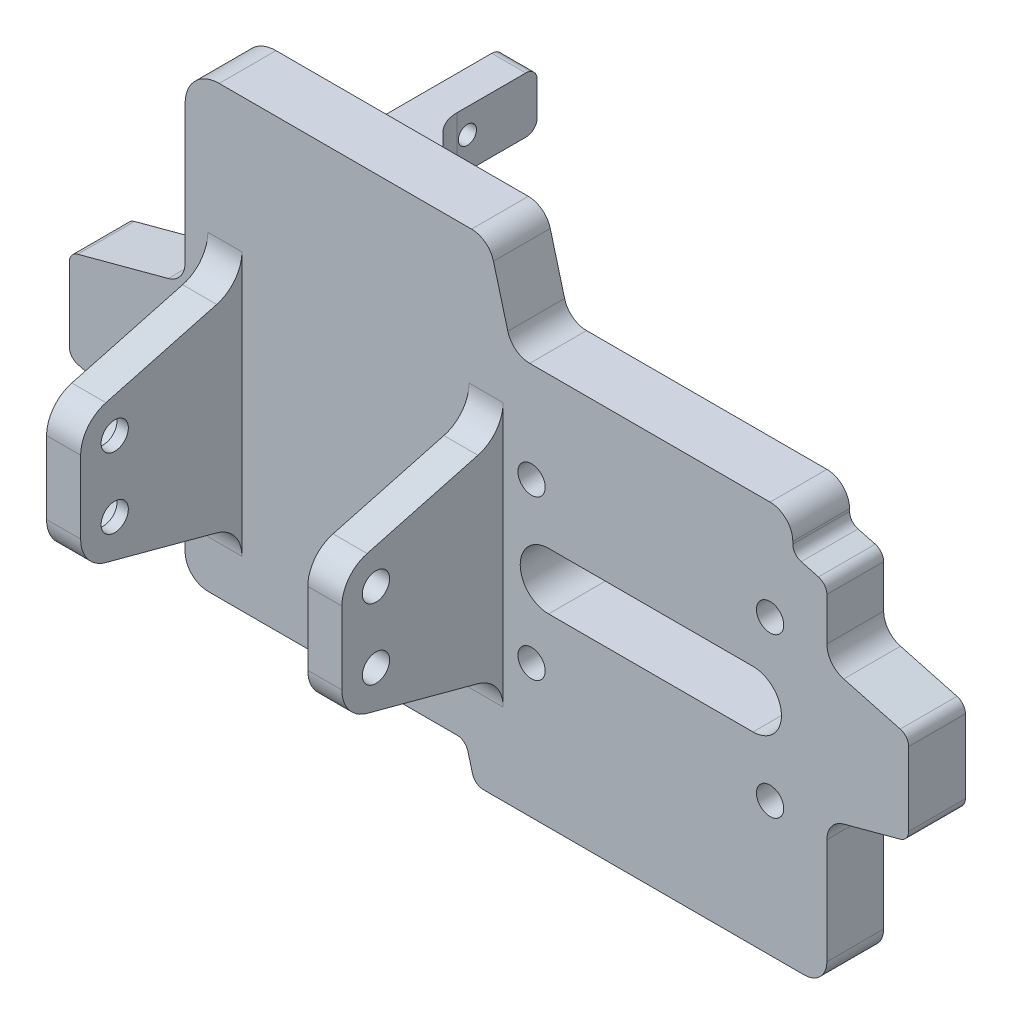
from build123d import *

# Parameters (mm, degrees)
SKETCH1_W                      = 53.5
SKETCH1_H                      = 31.55
BOSS_EXTRUDE1_DEPTH            = 2.5
BOSS_EXTRUDE2_DEPTH            = 5
FILLET1_R                      = 2
FILLET2_R                      = 1
BOSS_EXTRUDE3_DEPTH            = 3
FILLET3_R                      = 3
FILLET3_OF_MIRROR1_R           = 3
SKETCH4_W                      = 3
SKETCH4_H                      = 4.9
BOSS_EXTRUDE4_DEPTH            = 12.3
CHAMFER1_SIZE                  = 4
FILLET4_R                      = 3
FILLET5_R                      = 1
M2_CLEARANCE_HOLE1_D           = 2.4
M2X0_4_TAPPED_HOLE1_D          = 1.6
CBORE_FOR_M2_SHCS1_D           = 2.4
CBORE_FOR_M2_SHCS1_CBORE_D     = 4.4
CBORE_FOR_M2_SHCS1_CBORE_DEPTH = 2
CUT_EXTRUDE1_DEPTH             = 48.058421138


with BuildPart() as part:
    # Sketch1 → Boss-Extrude1 (new, symmetric)
    with BuildSketch(Plane.XY):
        Rectangle(SKETCH1_W, SKETCH1_H)
    extrude(amount=BOSS_EXTRUDE1_DEPTH, both=True)

    # Sketch2 → Boss-Extrude2 (add)
    with BuildSketch(Plane.XY.offset(2.5)):
        with BuildLine():
            Line((-26.75, 20.45), (-26.75, 15.775))
            Line((-26.75, 15.775), (2.056510052, 15.775))
            Line((2.056510052, 15.775), (0, 23.45))
            Line((0, 23.45), (-23.75, 23.45))
            ThreePointArc((-23.75, 23.45), (-25.871320344, 22.571320344), (-26.75, 20.45))
        make_face()
        Polygon((-36.95, 4), (-36.95, -4), (-26.75, -6.733081763), (-26.75, 6.733081763), align=None)
        Polygon((26.75, -15.775), (-2.053847577, -15.775), (-1.25, -18.775), (29.75, -18.775), (29.75, -5.929234186), (36.95, -4), (36.95, 4), (29.75, 5.929234186), (29.75, 12), (26.75, 12.803847577), align=None)
    extrude(amount=-BOSS_EXTRUDE2_DEPTH)

    # Fillet1
    fillet1_edges = [part.edges().sort_by_distance(p)[0] for p in [
        (-26.75, -6.733081763, 0),
        (-26.75, 6.733081763, 0),
        (0, 23.45, 0),
        (2.056510052, 15.775, 0),
        (29.75, -5.929234186, 0),
        (29.75, -18.775, 0),
        (29.75, 5.929234186, 0),
        (-26.75, -15.775, 0),
        (26.75, 15.775, 0),
    ]]
    fillet(fillet1_edges, radius=FILLET1_R)

    # Fillet2
    fillet2_edges = [part.edges().sort_by_distance(p)[0] for p in [
        (-36.95, 4, 0),
        (-36.95, -4, 0),
        (-1.25, -18.775, 0),
        (-2.053847577, -15.775, 0),
        (26.75, 12.803847577, 0),
        (29.75, 12, 0),
        (36.95, 4, 0),
        (36.95, -4, 0),
    ]]
    fillet(fillet2_edges, radius=FILLET2_R)

    # Sketch3 → Boss-Extrude3 (add)
    with BuildSketch(Plane.ZY.offset(21.75)):
        Polygon((16.700757193, -5.5), (16.700757193, 5.5), (2.5, 9.305081422), (2.5, -9.305081422), align=None)
    boss_extrude3 = extrude(amount=BOSS_EXTRUDE3_DEPTH)

    # Fillet3
    fillet3_edges = [part.edges().sort_by_distance(p)[0] for p in [
        (-23.25, -9.305081422, 2.5),
        (-23.25, -5.5, 16.700757193),
        (-23.25, 5.5, 16.700757193),
        (-23.25, 9.305081422, 2.5),
    ]]
    fillet(fillet3_edges, radius=FILLET3_R)

    # Mirror1: Boss-Extrude3 across plane
    add(boss_extrude3.mirror(Plane(origin=(-11.75, 0, 0), x_dir=(0, 0, 1), z_dir=(1, 0, 0))))

    # Fillet3 of Mirror1
    fillet3_of_mirror1_edges = [part.edges().sort_by_distance(p)[0] for p in [
        (-0.25, -9.305081422, 2.5),
        (-0.25, -5.5, 16.700757193),
        (-0.25, 5.5, 16.700757193),
        (-0.25, 9.305081422, 2.5),
    ]]
    fillet(fillet3_of_mirror1_edges, radius=FILLET3_OF_MIRROR1_R)

    # Sketch4 → Boss-Extrude4 (add)
    with BuildSketch(Plane(origin=(0, 0, -2.5), x_dir=(-1, 0, 0), z_dir=(0, 0, -1))):
        with Locations((14.55, 19)):
            Rectangle(SKETCH4_W, SKETCH4_H)
        with Locations((14.55, -8.6)):
            Rectangle(SKETCH4_W, SKETCH4_H)
    extrude(amount=BOSS_EXTRUDE4_DEPTH)

    # Chamfer1
    chamfer1_edges = [part.edges().sort_by_distance(p)[0] for p in [
        (-13.05, 19, -2.5),
        (-13.05, -8.6, -2.5),
    ]]
    chamfer(chamfer1_edges, length=CHAMFER1_SIZE)

    # Fillet4
    fillet4_edges = [part.edges().sort_by_distance(p)[0] for p in [
        (-13.05, -8.6, -6.5),
        (-9.05, 19, -2.5),
        (-9.05, -8.6, -2.5),
        (-13.05, 19, -6.5),
    ]]
    fillet(fillet4_edges, radius=FILLET4_R)

    # Fillet5
    fillet5_edges = [part.edges().sort_by_distance(p)[0] for p in [
        (-14.55, 16.55, -14.8),
        (-14.55, 21.45, -14.8),
        (-14.55, -11.05, -14.8),
        (-14.55, -6.15, -14.8),
    ]]
    fillet(fillet5_edges, radius=FILLET5_R)

    # M2 Clearance Hole1 (through all)
    with Locations(Plane.XY.offset(2.5)):
        with Locations((3.75, 7), (3.75, -7), (24.75, -7), (24.75, 7)):
            Hole(M2_CLEARANCE_HOLE1_D / 2)

    # M2x0.4 Tapped Hole1 (through all)
    with Locations(Plane.ZY.offset(16.05)):
        with Locations((-8.65, 19.3), (-8.65, -8.9)):
            Hole(M2X0_4_TAPPED_HOLE1_D / 2)

    # CBORE for M2 SHCS1 (through all)
    with Locations(Plane.ZY.offset(24.75)):
        with Locations((13.700757193, 3.198019036), (13.700757193, -3)):
            CounterBoreHole(CBORE_FOR_M2_SHCS1_D / 2, CBORE_FOR_M2_SHCS1_CBORE_D / 2, CBORE_FOR_M2_SHCS1_CBORE_DEPTH)

    # Sketch13 → Cut-Extrude1 (cut, through all)
    with BuildSketch(Plane.XY.offset(2.5)):
        with BuildLine():
            Line((5.25, 2.5), (23.25, 2.5))
            ThreePointArc((23.25, 2.5), (25.75, 0), (23.25, -2.5))
            Line((23.25, -2.5), (5.25, -2.5))
            ThreePointArc((5.25, -2.5), (2.75, 0), (5.25, 2.5))
        make_face()
    extrude(amount=-CUT_EXTRUDE1_DEPTH, mode=Mode.SUBTRACT)


solid = part.part
